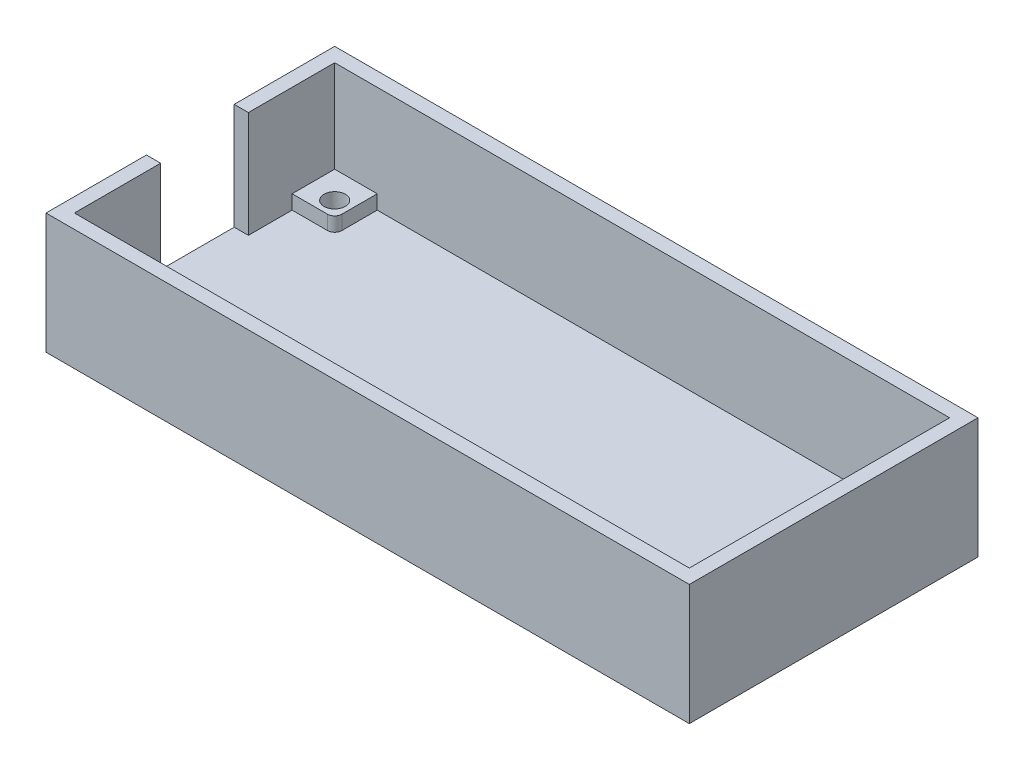
from build123d import *

# Parameters (mm, degrees)
SKETCH1_W               = 90.7
SKETCH1_H               = 40.7
SKETCH1_R               = 1.5
BOSS_EXTRUDE3_DEPTH     = 2
SKETCH2_W               = 90.7
SKETCH2_H               = 40.7
SKETCH2_W_2             = 86.7
SKETCH2_H_2             = 36.7
BOSS_EXTRUDE4_DEPTH     = 15
CUT_EXTRUDE1_REACH      = 96.497
CUTOUT_W                = 12.369316876
CUTOUT_H                = 15
SKETCH3_R               = 1.5
BOSS_EXTRUDE5_DEPTH     = 2
MIRROR2_COPY_1_SKETCH_R = 1.5
MIRROR2_COPY_1_DEPTH    = 2


with BuildPart() as part:
    # Sketch1 → Boss-Extrude3 (new body)
    with BuildSketch(Plane(origin=(0, 0, 0), x_dir=(1, 0, 0), z_dir=(0, 1, 0))):
        Rectangle(SKETCH1_W, SKETCH1_H)
        with Locations(Location((-39.55, 14.55, 0), (0, 0, 270))):
            Circle(SKETCH1_R, mode=Mode.SUBTRACT)
        with Locations(Location((39.55, 14.55, 0), (0, 0, 270))):
            Circle(SKETCH1_R, mode=Mode.SUBTRACT)
        with Locations(Location((-39.55, -14.55, 0), (0, 0, 270))):
            Circle(SKETCH1_R, mode=Mode.SUBTRACT)
        with Locations(Location((39.55, -14.55, 0), (0, 0, 270))):
            Circle(SKETCH1_R, mode=Mode.SUBTRACT)
    extrude(amount=BOSS_EXTRUDE3_DEPTH)

    # Sketch2 → Boss-Extrude4 (add)
    with BuildSketch(Plane(origin=(0, 2, 0), x_dir=(1, 0, 0), z_dir=(0, 1, 0))):
        Rectangle(SKETCH2_W, SKETCH2_H)
        Rectangle(SKETCH2_W_2, SKETCH2_H_2, mode=Mode.SUBTRACT)
    extrude(amount=BOSS_EXTRUDE4_DEPTH)

    # Cutout → Cut-Extrude1 (cut, up to next)
    with BuildSketch(Plane.ZY.offset(45.35), mode=Mode.PRIVATE) as cut_extrude1_sk1:
        with Locations((0, 9.5)):
            Rectangle(CUTOUT_W, CUTOUT_H)
    cut_extrude1_tool1 = extrude(cut_extrude1_sk1.sketch, amount=-CUT_EXTRUDE1_REACH, mode=Mode.PRIVATE) & part.part
    add(cut_extrude1_tool1.solids().sort_by_distance((-45.35, 9.5, 0))[0], mode=Mode.SUBTRACT)

    # Sketch3 → Boss-Extrude5 (add)
    with BuildSketch(Plane(origin=(0, 2, 0), x_dir=(1, 0, 0), z_dir=(0, 1, 0))):
        with BuildLine():
            Line((-43.35, 12.35), (-38.35, 12.35))
            ThreePointArc((-38.35, 12.35), (-37.642893219, 12.642893219), (-37.35, 13.35))
            Line((-37.35, 13.35), (-37.35, 18.35))
            Line((-37.35, 18.35), (-43.35, 18.35))
            Line((-43.35, 18.35), (-43.35, 12.35))
        make_face()
        with Locations(Location((-39.55, 14.55, 0), (0, 0, 270))):
            Circle(SKETCH3_R, mode=Mode.SUBTRACT)
    boss_extrude5 = extrude(amount=BOSS_EXTRUDE5_DEPTH)

    # Mirror1: Boss-Extrude5 across plane
    add(boss_extrude5.mirror(Plane(origin=(0, 0, 0), x_dir=(0, 0, 1), z_dir=(1, 0, 0))))

    # Mirror2: Boss-Extrude5 across plane
    add(boss_extrude5.mirror(Plane.XY))

    # Mirror2 copy 1 sketch → Mirror2 copy 1 (add)
    with BuildSketch(Plane(origin=(0, 2, 0), x_dir=(-1, 0, 0), z_dir=(0, 1, 0))):
        with BuildLine():
            Line((-43.35, 12.35), (-38.35, 12.35))
            ThreePointArc((-38.35, 12.35), (-37.642893219, 12.642893219), (-37.35, 13.35))
            Line((-37.35, 13.35), (-37.35, 18.35))
            Line((-37.35, 18.35), (-43.35, 18.35))
            Line((-43.35, 18.35), (-43.35, 12.35))
        make_face()
        with Locations(Location((-39.55, 14.55, 0), (0, 0, 270))):
            Circle(MIRROR2_COPY_1_SKETCH_R, mode=Mode.SUBTRACT)
    extrude(amount=MIRROR2_COPY_1_DEPTH)


solid = part.part
